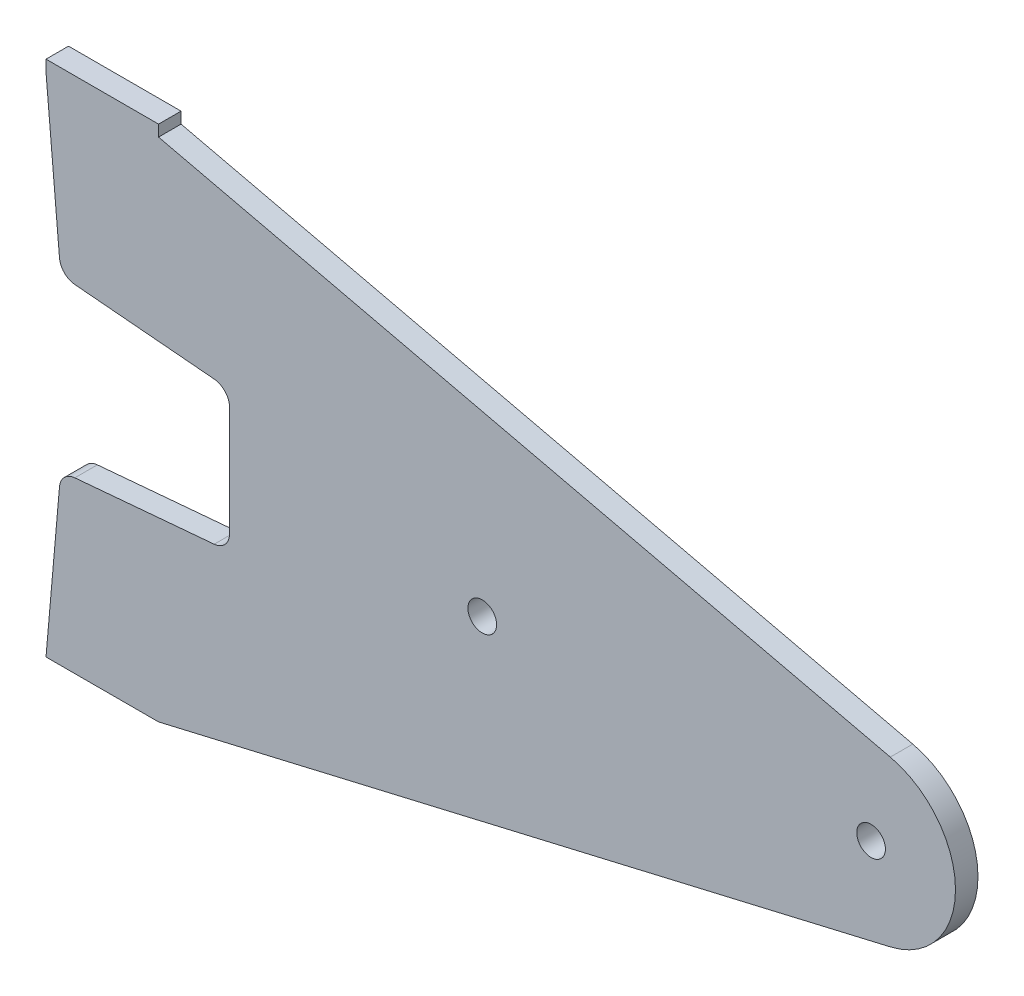
from build123d import *

# Parameters (mm, degrees)
SKETCH1_R           = 2.55
BOSS_EXTRUDE1_DEPTH = 4


with BuildPart() as part:
    # Sketch1 → Boss-Extrude1 (new body)
    with BuildSketch(Plane.XY):
        with BuildLine():
            Line((14.872885109, 17.599965411), (12.706250758, 42.361500851))
            Line((12.706250758, 42.361500851), (12.474619372, 45.008716695))
            Line((12.474619372, 45.008716695), (12.474619372, 47))
            Line((12.474619372, 47), (32.474619372, 47))
            Line((32.474619372, 47), (32.474619372, 45))
            Line((32.474619372, 45), (162.509181482, 14.606317485))
            ThreePointArc((162.509181482, 14.606317485), (174.095167783, 0), (162.509181482, -14.606317485))
            Line((162.509181482, -14.606317485), (32.810836001, -44.921414266))
            ThreePointArc((32.810836001, -44.921414266), (32.472346424, -44.980326678), (32.129340765, -45.000150484))
            Line((32.129340765, -45.000150484), (12.474619372, -45.008716695))
            Line((12.474619372, -45.008716695), (12.706250758, -42.361500851))
            Line((12.706250758, -42.361500851), (14.872885109, -17.599965411))
            ThreePointArc((14.872885109, -17.599965411), (15.740145918, -15.740145918), (17.599965411, -14.872885109))
            Line((17.599965411, -14.872885109), (42.361500851, -12.706250758))
            ThreePointArc((42.361500851, -12.706250758), (44.311843411, -11.744427787), (45.1, -9.717669606))
            Line((45.1, -9.717669606), (45.1, 9.717669606))
            ThreePointArc((45.1, 9.717669606), (44.311843411, 11.744427787), (42.361500851, 12.706250758))
            Line((42.361500851, 12.706250758), (17.599965411, 14.872885109))
            ThreePointArc((17.599965411, 14.872885109), (15.740145918, 15.740145918), (14.872885109, 17.599965411))
        make_face()
        with Locations((159.095167783, 0)):
            Circle(SKETCH1_R, mode=Mode.SUBTRACT)
        with Locations((90, 0)):
            Circle(SKETCH1_R, mode=Mode.SUBTRACT)
    extrude(amount=BOSS_EXTRUDE1_DEPTH)


solid = part.part
